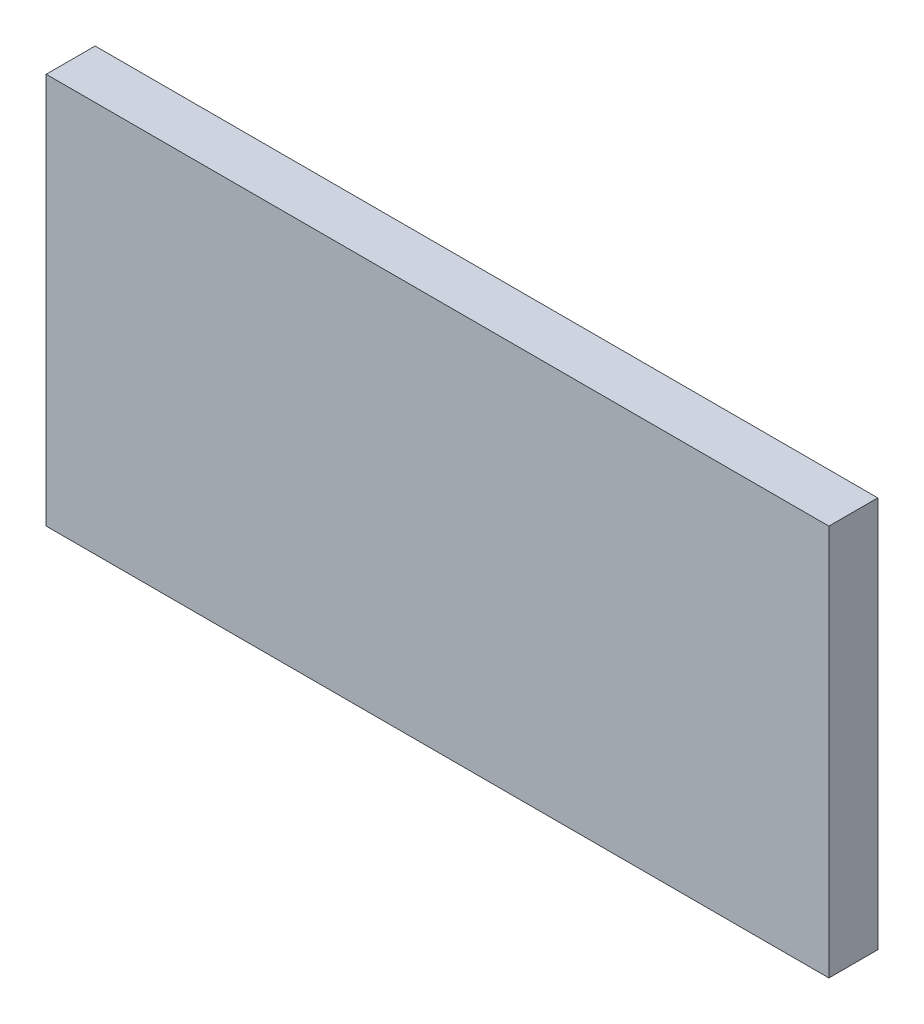
from build123d import *

# Parameters (mm, degrees)
SKETCH1_W           = 25.4
SKETCH1_H           = 12.7
BOSS_EXTRUDE1_DEPTH = 1.5875


with BuildPart() as part:
    # Sketch1 → Boss-Extrude1 (new body)
    with BuildSketch(Plane.XY):
        with Locations((0, 93.5)):
            Rectangle(SKETCH1_W, SKETCH1_H)
    extrude(amount=BOSS_EXTRUDE1_DEPTH)


solid = part.part
